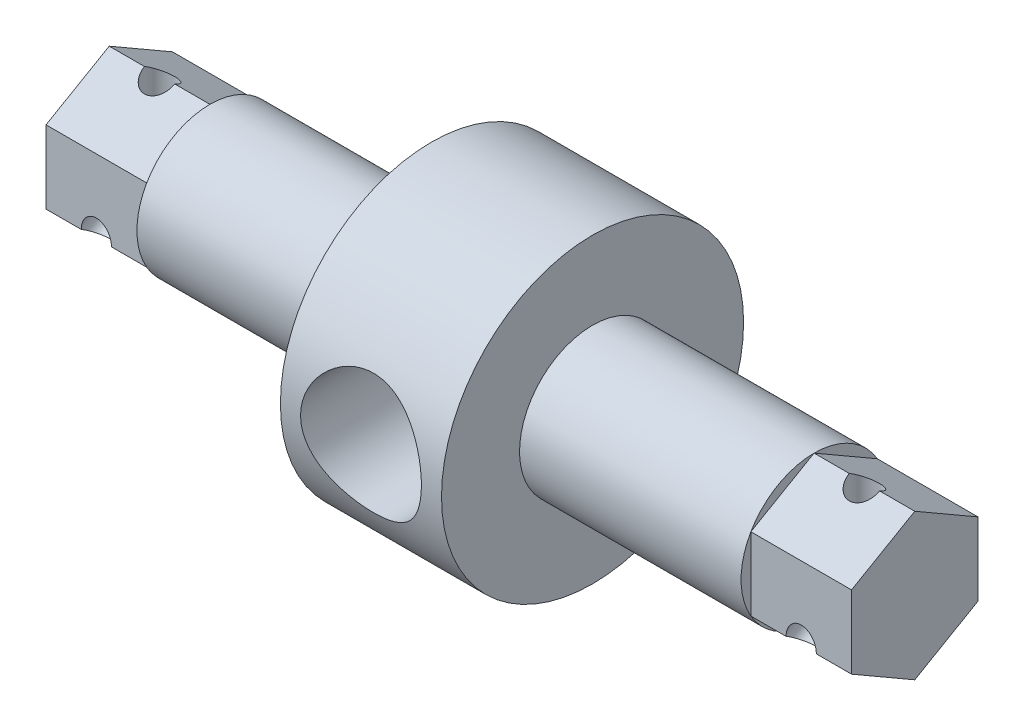
from build123d import *

# Parameters (mm, degrees)
SKETCH2_R               = 7.5
BOSS_EXTRUDE1_DEPTH     = 4
SKETCH4_R               = 3.625
BOSS_EXTRUDE3_DEPTH     = 15
BOSS_EXTRUDE4_DEPTH     = 20
CUT_EXTRUDE1_DEPTH      = 23.638462845
CUT_EXTRUDE1_DEPTH_BACK = 23.638462845
SKETCH1_R               = 3
SKETCH6_R               = 0.75
CUT_EXTRUDE2_DEPTH      = 2
CIRPATTERN1_COUNT       = 3
MIRROR1_COPY_1_SKETCH_R = 0.75
MIRROR1_COPY_1_DEPTH    = 2
MIRROR1_COPY_2_SKETCH_R = 0.75
MIRROR1_COPY_2_DEPTH    = 2


with BuildPart() as part:
    # Sketch2 → Boss-Extrude1 (new, symmetric)
    with BuildSketch(Plane(origin=(0, 0, 0), x_dir=(0, 0, -1), z_dir=(1, 0, 0))):
        Circle(SKETCH2_R)
    extrude(amount=BOSS_EXTRUDE1_DEPTH, both=True)

    # Sketch4 → Boss-Extrude3 (add, symmetric)
    with BuildSketch(Plane(origin=(0, 0, 0), x_dir=(0, 0, -1), z_dir=(1, 0, 0))):
        Circle(SKETCH4_R)
    extrude(amount=BOSS_EXTRUDE3_DEPTH, both=True)

    # Sketch5 → Boss-Extrude4 (add, symmetric)
    with BuildSketch(Plane.ZY):
        Polygon((0, 3.625), (-3.139342089, 1.8125), (-3.139342089, -1.8125), (0, -3.625), (3.139342089, -1.8125), (3.139342089, 1.8125), align=None)
    extrude(amount=BOSS_EXTRUDE4_DEPTH, both=True)

    # Sketch1 → Cut-Extrude1 (cut, two sides: drawn at the far end of the back side and taken through both)
    with BuildSketch(Plane.XY.offset(-CUT_EXTRUDE1_DEPTH_BACK)):
        Circle(SKETCH1_R)
    extrude(amount=CUT_EXTRUDE1_DEPTH + CUT_EXTRUDE1_DEPTH_BACK, mode=Mode.SUBTRACT)

    # Sketch6 → Cut-Extrude2 (cut)
    with BuildSketch(Plane(origin=(0, 3.625, -26.115381057), x_dir=(-1, 0, 0), z_dir=(0, -1, 0))):
        with Locations(Location((17.5, -26.115381057, 0), (0, 0, 180))):
            Circle(SKETCH6_R)
    cut_extrude2 = extrude(amount=CUT_EXTRUDE2_DEPTH, mode=Mode.SUBTRACT)

    # CirPattern1: Cut-Extrude2 ×3 about axis
    cirpattern1_axis = Axis((0, 0, 0), (1, 0, 0))
    for i in range(1, CIRPATTERN1_COUNT):
        add(cut_extrude2.rotate(cirpattern1_axis, i * 360 / CIRPATTERN1_COUNT), mode=Mode.SUBTRACT)

    # Mirror1: Cut-Extrude2 across plane
    add(cut_extrude2.mirror(Plane(origin=(0, 0, 0), x_dir=(0, 0, 1), z_dir=(1, 0, 0))), mode=Mode.SUBTRACT)

    # Mirror1 copy 1 sketch → Mirror1 copy 1 (cut)
    with BuildSketch(Plane(origin=(0, 20.804083425, 16.197032617), x_dir=(1, 0, 0), z_dir=(0, 0.4999999999999998, -0.8660254037844387))):
        with Locations((17.5, 26.115381057)):
            Circle(MIRROR1_COPY_1_SKETCH_R)
    extrude(amount=MIRROR1_COPY_1_DEPTH, mode=Mode.SUBTRACT)

    # Mirror1 copy 2 sketch → Mirror1 copy 2 (cut)
    with BuildSketch(Plane(origin=(0, -24.429083425, 9.91834844), x_dir=(1, 0, 0), z_dir=(0, 0.5000000000000004, 0.8660254037844384))):
        with Locations((17.5, 26.115381057)):
            Circle(MIRROR1_COPY_2_SKETCH_R)
    extrude(amount=MIRROR1_COPY_2_DEPTH, mode=Mode.SUBTRACT)


solid = part.part
